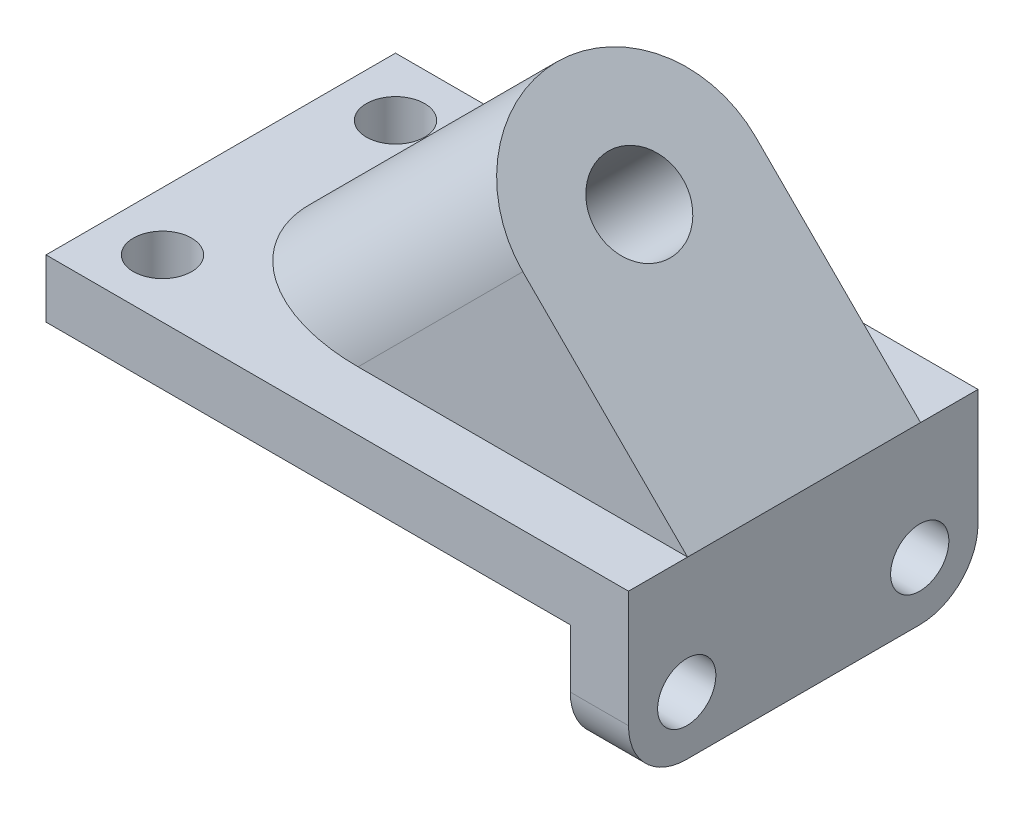
from build123d import *

# Parameters (mm, degrees)
SKETCH1_W           = 127
SKETCH1_H           = 76.2
BOSS_EXTRUDE1_DEPTH = 12.7
SKETCH2_W           = 12.7
SKETCH2_H           = 76.2
BOSS_EXTRUDE2_DEPTH = 38.1
FILLET1_R           = 12.7
FILLET2_R           = 12.7
BOSS_EXTRUDE3_REACH = 142.563
SKETCH7_R           = 9.525
SKETCH5_R           = 6.35
CUT_EXTRUDE1_DEPTH  = 38.1
SKETCH8_R           = 6.35
CUT_EXTRUDE2_DEPTH  = 38.1


with BuildPart() as part:
    # Sketch1 → Boss-Extrude1 (new body)
    with BuildSketch(Plane(origin=(0, 0, 0), x_dir=(1, 0, 0), z_dir=(0, 1, 0))):
        with Locations((63.5, 38.1)):
            Rectangle(SKETCH1_W, SKETCH1_H)
    extrude(amount=BOSS_EXTRUDE1_DEPTH)

    # Sketch2 → Boss-Extrude2 (add)
    with BuildSketch(Plane(origin=(0, 12.7, 0), x_dir=(1, 0, 0), z_dir=(0, 1, 0))):
        with Locations((120.65, 38.1)):
            Rectangle(SKETCH2_W, SKETCH2_H)
    extrude(amount=-BOSS_EXTRUDE2_DEPTH)

    # Fillet1
    fillet1_edges = [part.edges().sort_by_distance(p)[0] for p in [
        (120.65, -25.4, 0),
    ]]
    fillet(fillet1_edges, radius=FILLET1_R)

    # Fillet2
    fillet2_edges = [part.edges().sort_by_distance(p)[0] for p in [
        (120.65, -25.4, -76.2),
    ]]
    fillet(fillet2_edges, radius=FILLET2_R)

    # Boss-Extrude3: up to this face of the body (flat: up to its plane)
    boss_extrude3_end = Plane(part.part.faces().sort_by_distance((63.5, 12.7, -38.1))[0])
    # Sketch7 → Boss-Extrude3 (add, up to the picked face)
    with BuildSketch(Plane(origin=(69.85, 69.85, 0), x_dir=(0, 0, -1), z_dir=(0.7071067811865488, 0.7071067811865464, 0)), mode=Mode.PRIVATE) as boss_extrude3_sk1:
        with BuildLine():
            Line((63.678120433, -80.82230509), (12.878120433, -80.82230509))
            Line((12.878120433, -80.82230509), (12.878120433, -30.02230509))
            ThreePointArc((12.878120433, -30.02230509), (38.278120433, -4.62230509), (63.678120433, -30.02230509))
            Line((63.678120433, -30.02230509), (63.678120433, -80.82230509))
        make_face()
        with Locations(Location((38.278120433, -30.02230509, 0), (0, 0, 90))):
            Circle(SKETCH7_R, mode=Mode.SUBTRACT)
    boss_extrude3_tool1 = split(extrude(boss_extrude3_sk1.sketch, amount=-BOSS_EXTRUDE3_REACH, mode=Mode.PRIVATE), bisect_by=boss_extrude3_end, keep=Keep.BOTH, mode=Mode.PRIVATE)
    add(boss_extrude3_tool1.solids().sort_by(Axis((102.751477, 36.948523, -38.27812), (-0.7071067811865488, -0.7071067811865464, 0)))[0])

    # Sketch5 → Cut-Extrude1 (cut)
    with BuildSketch(Plane(origin=(0, 12.7, 0), x_dir=(1, 0, 0), z_dir=(0, 1, 0))):
        with Locations(Location((12.7, 63.5, 0), (0, 0, 270))):
            Circle(SKETCH5_R)
        with Locations(Location((12.7, 12.7, 0), (0, 0, 270))):
            Circle(SKETCH5_R)
    extrude(amount=-CUT_EXTRUDE1_DEPTH, mode=Mode.SUBTRACT)

    # Sketch8 → Cut-Extrude2 (cut)
    with BuildSketch(Plane(origin=(127, 0, 0), x_dir=(0, 0, -1), z_dir=(1, 0, 0))):
        with Locations((12.7, -12.7)):
            Circle(SKETCH8_R)
        with Locations((63.5, -12.7)):
            Circle(SKETCH8_R)
    extrude(amount=-CUT_EXTRUDE2_DEPTH, mode=Mode.SUBTRACT)


solid = part.part
